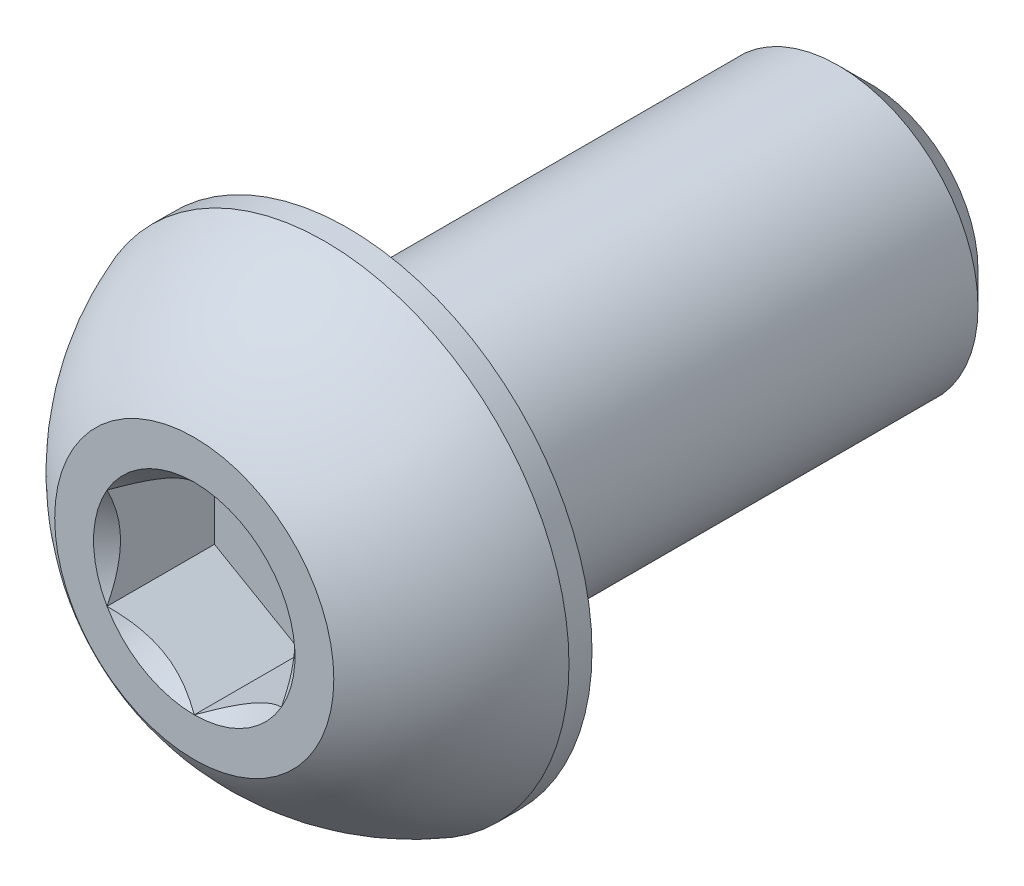
from build123d import *

# Parameters (mm, degrees)
CUT_EXTRUDE2_DEPTH = 3.08


with BuildPart() as part:
    # Sketch10 → Revolve3 (revolve)
    with BuildSketch(Plane(origin=(0, 0, 0), x_dir=(0, 0, -1), z_dir=(1, 0, 0))):
        Polygon((18.4625, 4), (19.4, 3.0625), (19.4, 0), (4.4, 0), (4.4, 4), align=None)
    revolve(axis=Axis((0, 0, 0), (0, 0, -1)))

    # Sketch7 → Revolve2 (revolve)
    with BuildSketch(Plane(origin=(0, 0, 0), x_dir=(0, 0, -1), z_dir=(1, 0, 0))):
        with BuildLine():
            Line((3.74, 7), (4.4, 7))
            Line((4.4, 7), (4.4, 0))
            Line((4.4, 0), (0, 0))
            Line((0, 0), (0, 4))
            ThreePointArc((0, 4), (1.621972026, 5.809208208), (3.74, 7))
        make_face()
    revolve(axis=Axis((0, 0, 0), (0, 0, -1)))

    # Sketch5 → Cut-Extrude2 (cut)
    with BuildSketch(Plane.XY):
        Polygon((2.5, -1.443375673), (2.5, 1.443375673), (0, 2.886751346), (-2.5, 1.443375673), (-2.5, -1.443375673), (0, -2.886751346), align=None)
    extrude(amount=-CUT_EXTRUDE2_DEPTH, mode=Mode.SUBTRACT)

    # Cut-Extrude3 cone 1 section (through the dimple's axis) → Cut-Extrude3 (revolve, cut)
    with BuildSketch(Plane(origin=(0, 0, 0), x_dir=(0, -1, 0), z_dir=(1, 0, 0))):
        Polygon((0, 0), (2.886751346, 0), (0, 2.886751346), align=None)
    revolve(axis=Axis((0, 0, 0), (0, 0, -1)), mode=Mode.SUBTRACT)


solid = part.part
